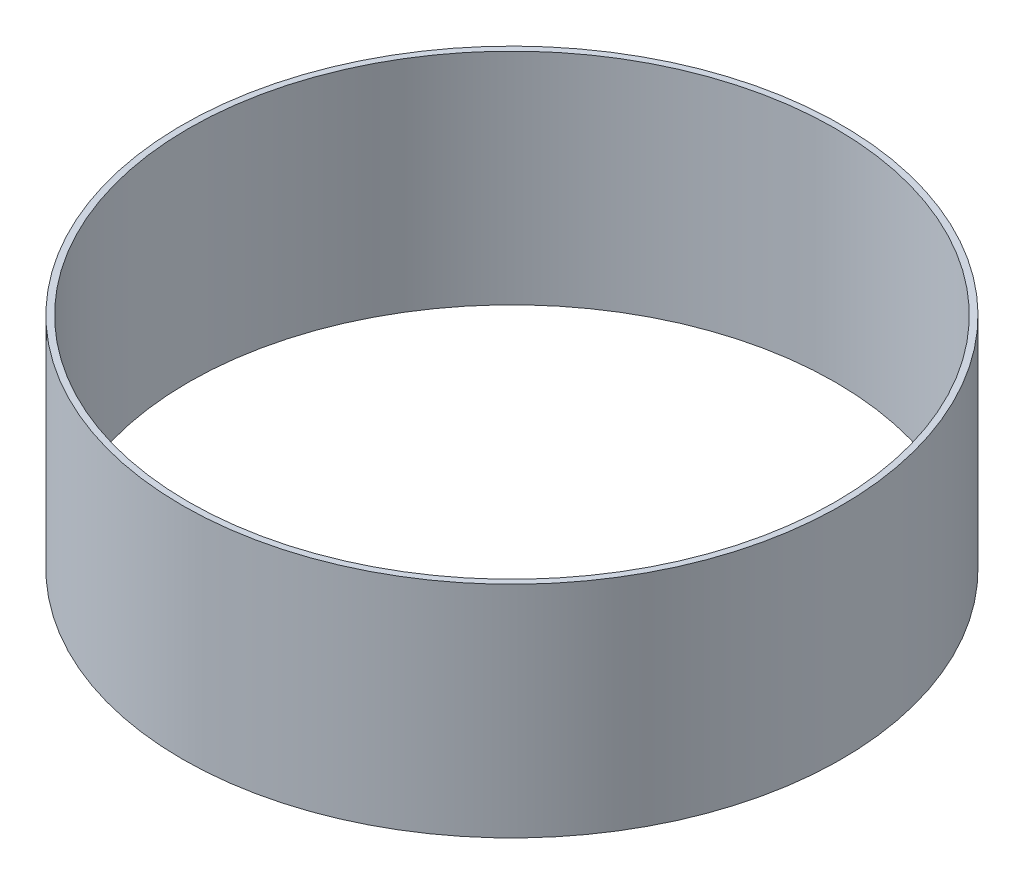
from build123d import *

# Parameters (mm, degrees)
SKETCH2_R           = 76.2
SKETCH2_R_2         = 74.7776
BOSS_EXTRUDE1_DEPTH = 25.4


with BuildPart() as part:
    # Sketch2 → Boss-Extrude1 (new, symmetric)
    with BuildSketch(Plane(origin=(0, 0, 0), x_dir=(1, 0, 0), z_dir=(0, 1, 0))):
        with Locations(Location((0, 0, 0), (0, 0, 270))):
            Circle(SKETCH2_R)
        with Locations(Location((0, 0, 0), (0, 0, 270))):
            Circle(SKETCH2_R_2, mode=Mode.SUBTRACT)
    extrude(amount=BOSS_EXTRUDE1_DEPTH, both=True)


solid = part.part
